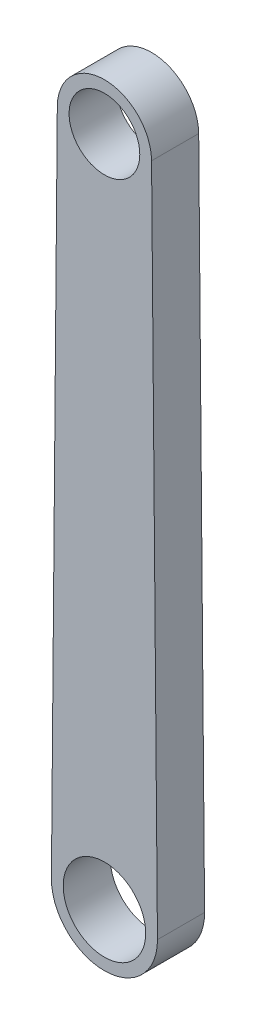
from build123d import *

# Parameters (mm, degrees)
SKETCH_1_R      = 3.5
SKETCH_1_R_2    = 3
EXTRUDE_1_DEPTH = 2


with BuildPart() as part:
    # 草图1 → 凸台-拉伸1 (new, symmetric)
    with BuildSketch(Plane.XY):
        with BuildLine():
            Line((4.499826866, -56.960526316), (3.999846104, 0.035087719))
            ThreePointArc((3.999846104, 0.035087719), (0, 4), (-3.999846104, 0.035087719))
            Line((-3.999846104, 0.035087719), (-4.499826866, -56.960526316))
            ThreePointArc((-4.499826866, -56.960526316), (0, -61.5), (4.499826866, -56.960526316))
        make_face()
        with Locations((0, -57)):
            Circle(SKETCH_1_R, mode=Mode.SUBTRACT)
        Circle(SKETCH_1_R_2, mode=Mode.SUBTRACT)
    extrude(amount=EXTRUDE_1_DEPTH, both=True)


solid = part.part
